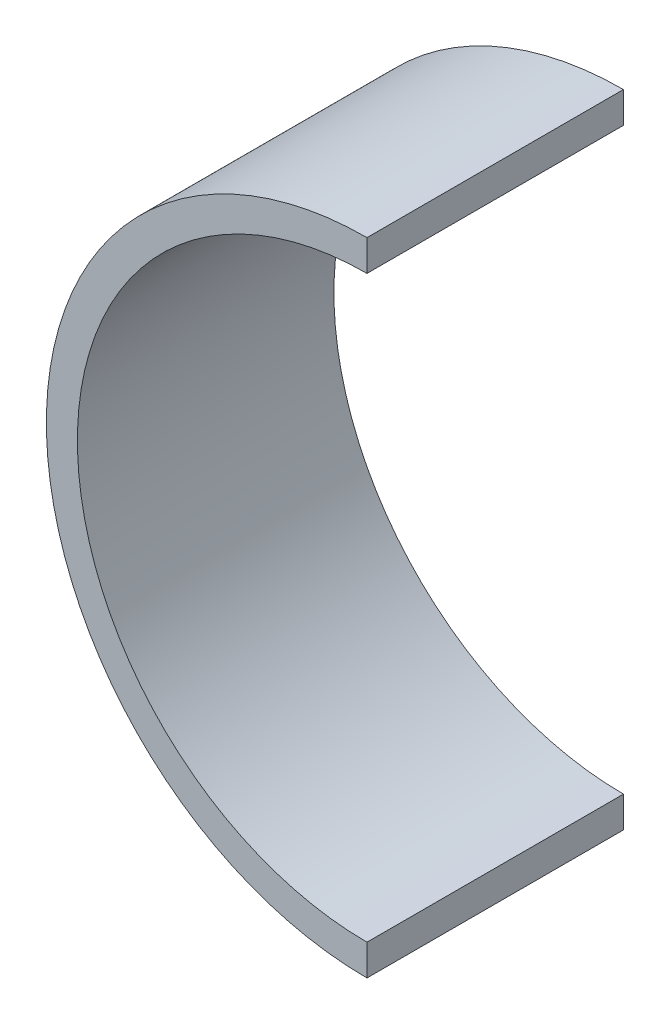
from build123d import *

# Parameters (mm, degrees)
BOSS_EXTRUDE1_DEPTH      = 124
BOSS_EXTRUDE1_DEPTH_BACK = 124


with BuildPart() as part:
    # Sketch2 → Boss-Extrude1 (new, two sides: drawn at the far end of the back side and taken through both)
    with BuildSketch(Plane.XY.offset(-BOSS_EXTRUDE1_DEPTH_BACK)):
        with BuildLine():
            Line((0, 310), (0, 280))
            ThreePointArc((0, 280), (-280, 0), (0, -280))
            Line((0, -280), (0, -310))
            ThreePointArc((0, -310), (-310, 0), (0, 310))
        make_face()
    extrude(amount=BOSS_EXTRUDE1_DEPTH + BOSS_EXTRUDE1_DEPTH_BACK)


solid = part.part
